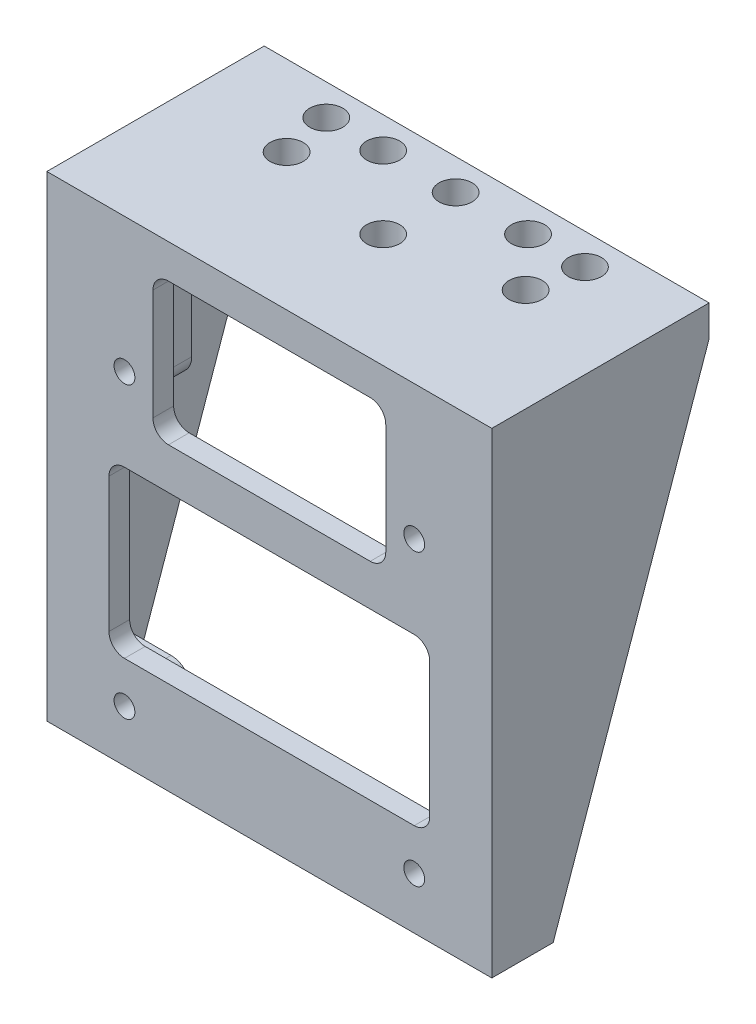
from build123d import *
from build123d.topology import SkipClean

# Parameters (mm, degrees)
SKETCH_1_W               = 43
SKETCH_1_H               = 49
SKETCH_1_R               = 1.005
EXTRUDE_1_DEPTH          = 2
EXTRUDE_2_DEPTH          = 19
EXTRUDE_2_DEPTH_BACK     = 2
SKETCH_2_W               = 43
SKETCH_2_H               = 3
EXTRUDE_START            = -21.5
EXTRUDE_3_DEPTH          = 2
EXTRUDE_START_2          = 21.5
EXTRUDE_5_DEPTH          = 2
SKETCH_5_R               = 1.6
CUT_EXTRUDE_1_DEPTH      = 57.351574956
CUT_EXTRUDE_3_DEPTH      = 40.398604036
CUT_EXTRUDE_3_DEPTH_BACK = 40.398604036
SKETCH_8_W               = 31
SKETCH_8_H               = 16
EXTRUDE_START_3          = 2.5
SKETCH_12_R              = 1.005
EXTRUDE_6_DEPTH          = 2.5
SKETCH_13_W              = 43
SKETCH_13_H              = 5.5
CUT_EXTRUDE_4_DEPTH      = 41.401113846
FILLET_1_R               = 1.5


with BuildPart() as part:
    # 草图1 → 凸台-拉伸1 (new body)
    with BuildSketch(Plane.XY):
        Rectangle(SKETCH_1_W, SKETCH_1_H)
        with Locations((-14, 14)):
            Circle(SKETCH_1_R, mode=Mode.SUBTRACT)
        with Locations((14, 14)):
            Circle(SKETCH_1_R, mode=Mode.SUBTRACT)
        with Locations((14, -14)):
            Circle(SKETCH_1_R, mode=Mode.SUBTRACT)
        with Locations((-14, -14)):
            Circle(SKETCH_1_R, mode=Mode.SUBTRACT)
    extrude(amount=EXTRUDE_1_DEPTH)

    # 草图2 → 凸台-拉伸2 (add, two sides: drawn at the far end of the back side and taken through both)
    with BuildSketch(Plane(origin=(0, 0, 0), x_dir=(-1, 0, 0), z_dir=(0, 0, -1)).offset(-EXTRUDE_2_DEPTH_BACK)):
        with Locations((0, 25.5)):
            Rectangle(SKETCH_2_W, SKETCH_2_H)
    extrude(amount=EXTRUDE_2_DEPTH + EXTRUDE_2_DEPTH_BACK)

    # 草图4 → 凸台-拉伸3 (add)
    with BuildSketch(Plane(origin=(0, 0, 0), x_dir=(0, 0, -1), z_dir=(1, 0, 0)).offset(EXTRUDE_START)):
        Polygon((19, 24), (0, 24), (0, -24.5), (2, -24.5), align=None)
    extrude(amount=EXTRUDE_3_DEPTH)

    # 草图4<2> → 凸台-拉伸5 (add)
    with BuildSketch(Plane(origin=(0, 0, 0), x_dir=(0, 0, -1), z_dir=(1, 0, 0)).offset(EXTRUDE_START_2)):
        Polygon((19, 24), (0, 24), (0, -24.5), (2, -24.5), align=None)
    extrude(amount=-EXTRUDE_5_DEPTH)

    # 草图5 → 切除-拉伸1 (cut, through all)
    with BuildSketch(Plane.XZ.offset(-24)):
        with Locations(Location((-12.5, -16, 0), (0, 0, 270))):
            Circle(SKETCH_5_R)
        with Locations(Location((12.5, -16, 0), (0, 0, 90))):
            Circle(SKETCH_5_R)
        with Locations(Location((11.548494156, -11.216457095, 0), (0, 0, 270))):
            Circle(SKETCH_5_R)
        with Locations(Location((-11.548494156, -11.216457095, 0), (0, 0, 90))):
            Circle(SKETCH_5_R)
        with Locations(Location((-7, -16, 0), (0, 0, 270))):
            Circle(SKETCH_5_R)
        with Locations(Location((7, -16, 0), (0, 0, 270))):
            Circle(SKETCH_5_R)
        with Locations(Location((0, -16, 0), (0, 0, 270))):
            Circle(SKETCH_5_R)
        with Locations(Location((0, -9, 0), (0, 0, 270))):
            Circle(SKETCH_5_R)
    extrude(amount=-CUT_EXTRUDE_1_DEPTH, mode=Mode.SUBTRACT)

    # 草图8 → 切除-拉伸3 (cut, two sides: drawn at the far end of the back side and taken through both)
    with BuildSketch(Plane(origin=(0, 0, 0), x_dir=(-1, 0, 0), z_dir=(0, 0, -1)).offset(-CUT_EXTRUDE_3_DEPTH_BACK)):
        Polygon((11.25, 20), (11.25, 23.7), (-0.75, 23.7), (-11.25, 23.7), (-11.25, 10), (11.25, 10), align=None)
        with Locations((0, -2)):
            Rectangle(SKETCH_8_W, SKETCH_8_H)
    extrude(amount=CUT_EXTRUDE_3_DEPTH + CUT_EXTRUDE_3_DEPTH_BACK, mode=Mode.SUBTRACT)

    # 草图12 → 凸台-拉伸6 (add)
    # profile 1 of 4: a face of its own
    with SkipClean():  # the faces are left unmerged after this step: merging them gives an invalid solid
        with BuildSketch(Plane(origin=(0, 0, 0), x_dir=(-1, 0, 0), z_dir=(0, 0, -1)).offset(EXTRUDE_START_3)):
            with BuildLine():
                Line((12, -14), (12, -24.5))
                Line((12, -24.5), (19.5, -24.5))
                Line((19.5, -24.5), (19.5, -12))
                Line((19.5, -12), (14, -12))
                ThreePointArc((14, -12), (12.585786438, -12.585786438), (12, -14))
            make_face()
            with Locations((14, -14)):
                Circle(SKETCH_12_R, mode=Mode.SUBTRACT)
        # profile 2 of 4: a face of its own
        with BuildSketch(Plane(origin=(0, 0, 0), x_dir=(-1, 0, 0), z_dir=(0, 0, -1)).offset(EXTRUDE_START_3)):
            with BuildLine():
                Line((-19.5, -12), (-14, -12))
                ThreePointArc((-14, -12), (-12.585786438, -12.585786438), (-12, -14))
                Line((-12, -14), (-12, -24.5))
                Line((-12, -24.5), (-19.5, -24.5))
                Line((-19.5, -24.5), (-19.5, -12))
            make_face()
            with Locations((-14, -14)):
                Circle(SKETCH_12_R, mode=Mode.SUBTRACT)
        # profile 3 of 4: a face of its own
        with BuildSketch(Plane(origin=(0, 0, 0), x_dir=(-1, 0, 0), z_dir=(0, 0, -1)).offset(EXTRUDE_START_3)):
            with BuildLine():
                Line((14, 12), (19.5, 12))
                Line((19.5, 12), (19.5, 24))
                Line((19.5, 24), (12, 24))
                Line((12, 24), (12, 14))
                ThreePointArc((12, 14), (12.585786438, 12.585786438), (14, 12))
            make_face()
            with Locations((14, 14)):
                Circle(SKETCH_12_R, mode=Mode.SUBTRACT)
        # profile 4 of 4: a face of its own
        with BuildSketch(Plane(origin=(0, 0, 0), x_dir=(-1, 0, 0), z_dir=(0, 0, -1)).offset(EXTRUDE_START_3)):
            with BuildLine():
                Line((-12, 24), (-12, 14))
                ThreePointArc((-12, 14), (-12.585786438, 12.585786438), (-14, 12))
                Line((-14, 12), (-19.5, 12))
                Line((-19.5, 12), (-19.5, 24))
                Line((-19.5, 24), (-12, 24))
            make_face()
            with Locations((-14, 14)):
                Circle(SKETCH_12_R, mode=Mode.SUBTRACT)
        extrude(amount=-EXTRUDE_6_DEPTH)

    # 草图13 → 切除-拉伸4 (cut, through all)
    with SkipClean():  # the faces are left unmerged after this step: merging them gives an invalid solid
        with BuildSketch(Plane.XY.offset(2)):
            with Locations((0, -21.75)):
                Rectangle(SKETCH_13_W, SKETCH_13_H)
        extrude(amount=-CUT_EXTRUDE_4_DEPTH, mode=Mode.SUBTRACT)

    # 圆角1
    fillet_1_edges = [part.edges().sort_by_distance(p)[0] for p in [
        (11.25, 10, 1),
        (11.25, 23.7, 1),
        (-11.25, 23.7, 1),
        (-11.25, 10, 1),
        (-15.5, 6, 1),
        (-15.5, -10, 1),
        (15.5, -10, 1),
        (15.5, 6, 1),
        (-19.5, -12, -1.25),
        (19.5, -12, -1.25),
        (-19.5, 12, -1.25),
        (-12, 24, -1.25),
        (12, 24, -1.25),
        (19.5, 12, -1.25),
        (-19.5, 24, -10.75),
        (19.5, 24, -10.75),
    ]]
    fillet(fillet_1_edges, radius=FILLET_1_R)


solid = part.part
